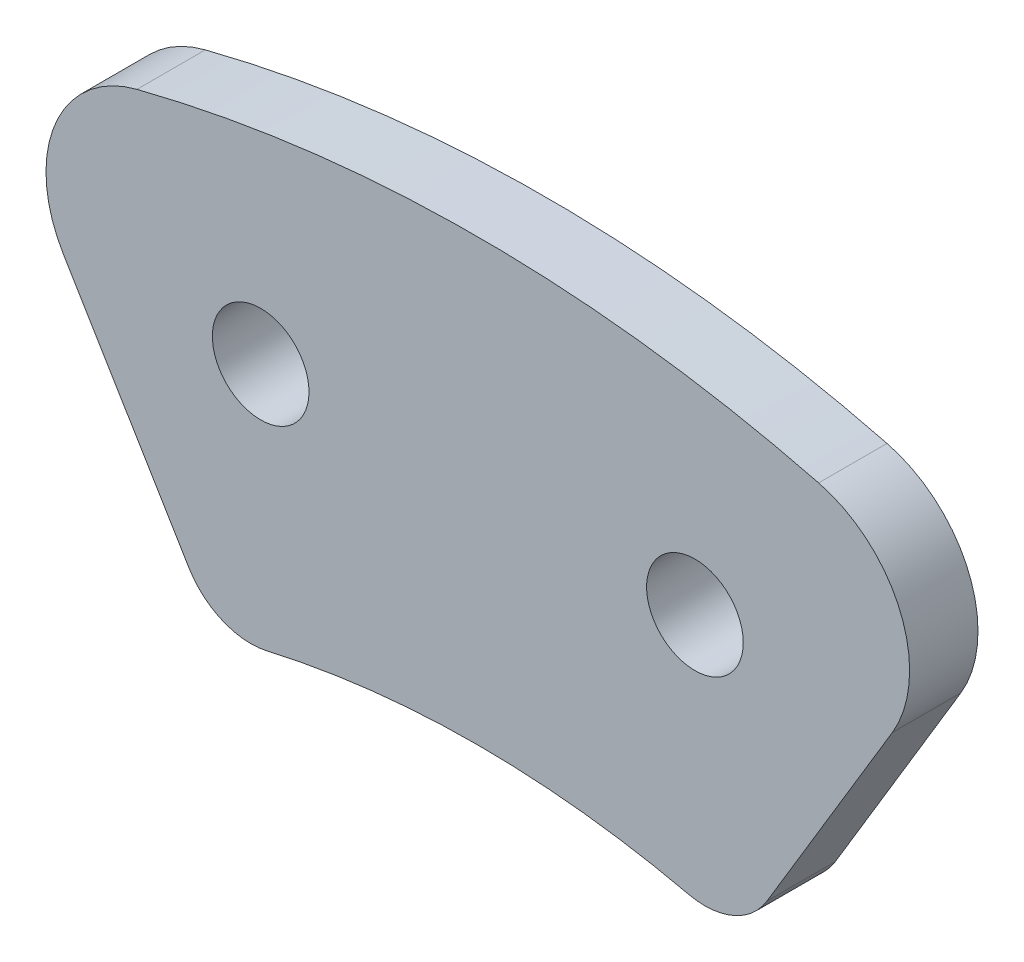
from build123d import *

# Parameters (mm, degrees)
SKETCH_2_R      = 1.06
EXTRUDE_1_DEPTH = 0.75
FILLET_1_R      = 2.65
FILLET_2_R      = 1.59


with BuildPart() as part:
    # 草图2 → 拉伸1 (new, symmetric)
    with BuildSketch(Plane.XY):
        with BuildLine():
            Line((5.730721037, 19.810931144), (8.300141741, 24.087165303))
            Line((8.300141741, 24.087165303), (10.818460752, 28.278351963))
            ThreePointArc((10.818460752, 28.278351963), (0, 30.277124745), (-10.818460752, 28.278351963))
            Line((-10.818460752, 28.278351963), (-5.730721037, 19.810931144))
            ThreePointArc((-5.730721037, 19.810931144), (0, 20.623146132), (5.730721037, 19.810931144))
        make_face()
        with Locations((-4.7625, 25.477124745)):
            Circle(SKETCH_2_R, mode=Mode.SUBTRACT)
        with Locations((4.7625, 25.477124745)):
            Circle(SKETCH_2_R, mode=Mode.SUBTRACT)
    extrude(amount=EXTRUDE_1_DEPTH, both=True)

    # 圆角1
    fillet_1_edges = [part.edges().sort_by_distance(p)[0] for p in [
        (-10.818460752, 28.278351963, 0),
        (10.818460752, 28.278351963, 0),
    ]]
    fillet(fillet_1_edges, radius=FILLET_1_R)

    # 圆角2
    fillet_2_edges = [part.edges().sort_by_distance(p)[0] for p in [
        (-5.730721037, 19.810931144, 0),
        (5.730721037, 19.810931144, 0),
    ]]
    fillet(fillet_2_edges, radius=FILLET_2_R)


solid = part.part
